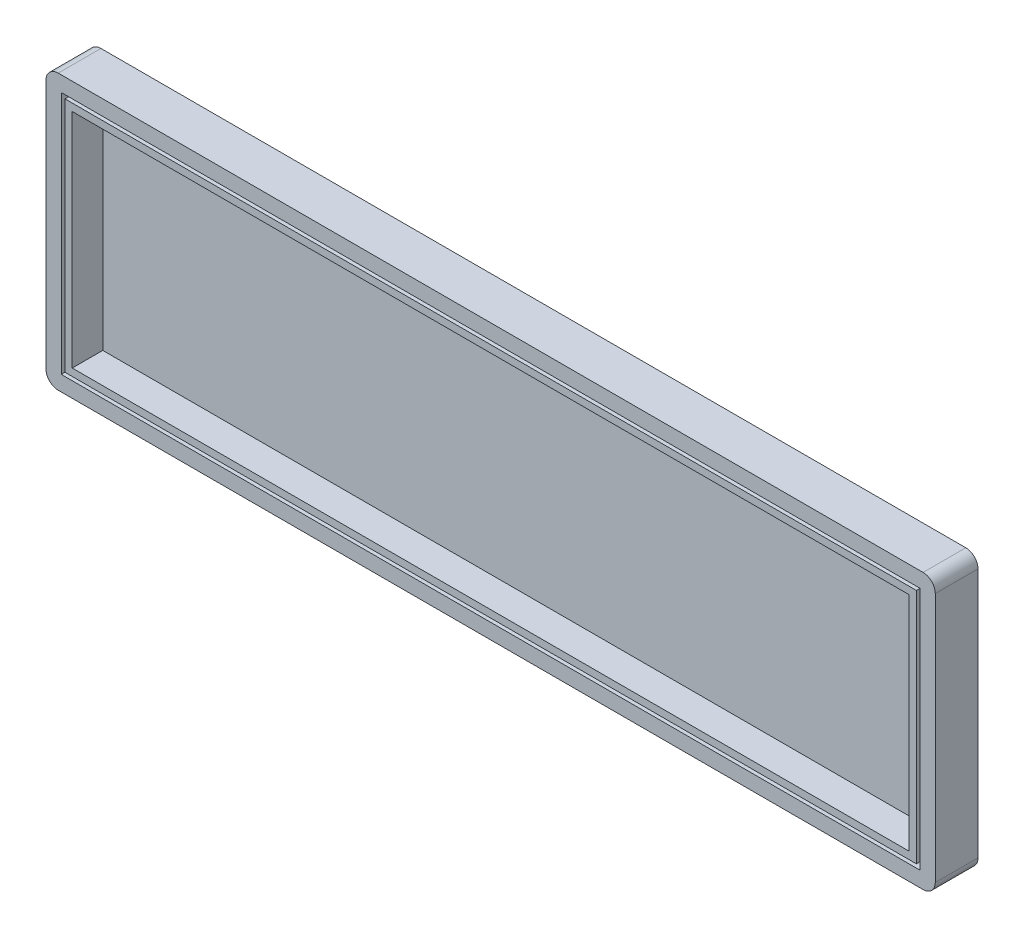
from build123d import *

# Parameters (mm, degrees)
SKETCH1_W            = 145.7
SKETCH1_H            = 45
BOSS_EXTRUDE1_DEPTH  = 2
SKETCH17_W           = 145.7
SKETCH17_H           = 45
SKETCH17_W_2         = 140.7
SKETCH17_H_2         = 40
SKETCH17_W_3         = 139.5
SKETCH17_H_3         = 38.8
SKETCH17_W_4         = 137.1
SKETCH17_H_4         = 36.4
BOSS_EXTRUDE10_DEPTH = 5
FILLET2_R            = 2


with BuildPart() as part:
    # Sketch1 → Boss-Extrude1 (new body)
    with BuildSketch(Plane.XY):
        with Locations((72.85, 22.5)):
            Rectangle(SKETCH1_W, SKETCH1_H)
    extrude(amount=BOSS_EXTRUDE1_DEPTH)

    # Sketch17 → Boss-Extrude10 (add)
    # profile 1 of 2: a face of its own
    with BuildSketch(Plane.XY.offset(2)):
        with Locations((72.85, 22.5)):
            Rectangle(SKETCH17_W, SKETCH17_H)
        with Locations((72.85, 22.5)):
            Rectangle(SKETCH17_W_2, SKETCH17_H_2, mode=Mode.SUBTRACT)
    # profile 2 of 2: a face of its own
    with BuildSketch(Plane.XY.offset(2)):
        with Locations((72.85, 22.5)):
            Rectangle(SKETCH17_W_3, SKETCH17_H_3)
        with Locations((72.85, 22.5)):
            Rectangle(SKETCH17_W_4, SKETCH17_H_4, mode=Mode.SUBTRACT)
    extrude(amount=BOSS_EXTRUDE10_DEPTH)

    # Fillet2
    fillet2_edges = [part.edges().sort_by_distance(p)[0] for p in [
        (0, 45, 3.5),
        (145.7, 45, 3.5),
        (145.7, 0, 3.5),
        (0, 0, 3.5),
    ]]
    fillet(fillet2_edges, radius=FILLET2_R)


solid = part.part
